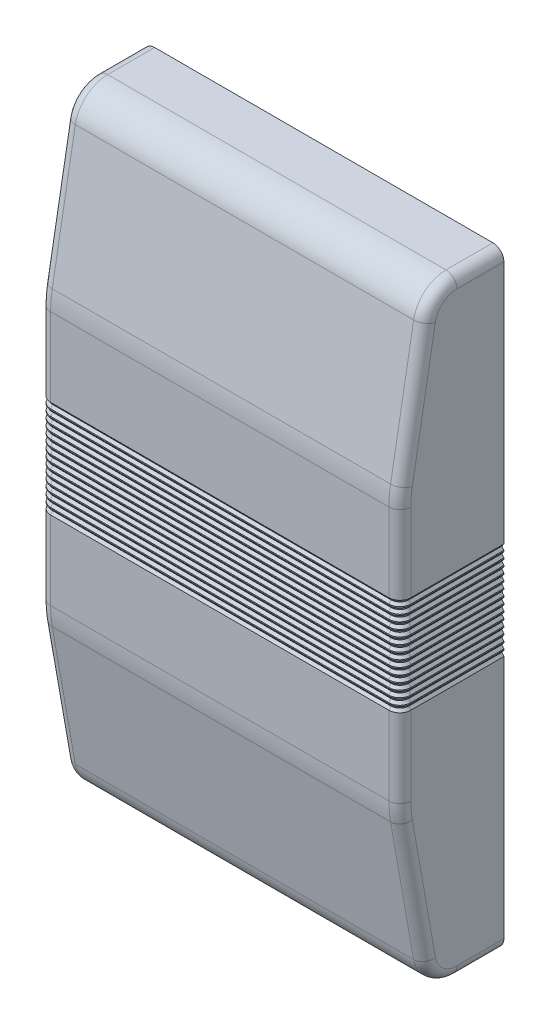
from build123d import *

# Parameters (mm, degrees)
EXTRUDE_SIDE_PROFILE_DEPTH = 65.8
COSMETIC_FILLET_R          = 20
COSMETIC_FILLET_2_R        = 6
COSMETIC_FILLET_3_R        = 2
SHELL1_T                   = -3.2
FILLET_INTERNALS_R         = 1.5
SKETCH3_W                  = 56.4
SKETCH3_H                  = 1.5999999999999952
SKETCH3_H_2                = 1.6000000000000085
EXTRUDE_MATING_BOSS_DEPTH  = 1.5
TOLERANCE_MATING_BOSS_BY   = 0.2
TOLERANCE_MATING_BOSS_2_BY = 0.2
TOLERANCE_MATING_BOSS_3_BY = 0.2
TOLERANCE_MATING_BOSS_4_BY = 0.2
PATTERN_GROOVES_COUNT      = 8
PATTERN_GROOVES_PITCH      = 1.2
PATTERN_GROOVES_COL_COUNT  = 8
PATTERN_GROOVES_COL_PITCH  = 1.2


with BuildPart() as part:
    # Sketch2 → Extrude side profile (new body)
    with BuildSketch(Plane(origin=(0, 0, 0), x_dir=(0, 0, -1), z_dir=(1, 0, 0))):
        Polygon((0, 111.09999999999997), (-13.61321073935639, 111.1), (-19.000000000000014, 80.55), (-19.000000000000014, 30.549999999999994), (-13.61321073935639, 0), (0, 0), align=None)
    extrude(amount=EXTRUDE_SIDE_PROFILE_DEPTH)

    # Cosmetic fillet
    cosmetic_fillet_edges = [part.edges().sort_by_distance(p)[0] for p in [
        (32.9, 30.549999999999994, 19.000000000000014),
        (32.9, 80.55, 19.000000000000014),
    ]]
    fillet(cosmetic_fillet_edges, radius=COSMETIC_FILLET_R)

    # Cosmetic fillet 2
    cosmetic_fillet_2_edges = [part.edges().sort_by_distance(p)[0] for p in [
        (32.9, 0, 13.61321073935639),
        (32.9, 111.1, 13.61321073935639),
    ]]
    fillet(cosmetic_fillet_2_edges, radius=COSMETIC_FILLET_2_R)

    # Cosmetic fillet 3
    cosmetic_fillet_3_edges = [part.edges().sort_by_distance(p)[0] for p in [
        (0, 55.5499999999999, 19.000000000000014),
        (65.8, 55.5499999999999, 19.000000000000014),
        (0, 16.892460325589084, 16.591807265305057),
        (0, 30.556658415565202, 18.923893961834924),
        (0, 80.54334158443459, 18.923893961834935),
        (65.8, 16.892460325589084, 16.591807265305057),
        (65.8, 30.556658415565202, 18.923893961834924),
        (65.8, 80.54334158443459, 18.923893961834935),
        (0, 0, 4.289306476146356),
        (65.8, 0, 4.289306476146356),
        (0, 94.20753967441081, 16.591807265305075),
        (0, 109.69626665871385, 12.435338610411943),
        (0, 1.4037333412861264, 12.435338610411943),
        (65.8, 94.20753967441081, 16.591807265305075),
        (65.8, 109.69626665871385, 12.435338610411943),
        (65.8, 1.4037333412861264, 12.435338610411943),
        (0, 111.09999999999998, 4.28930647614635),
        (65.8, 111.09999999999998, 4.28930647614635),
    ]]
    fillet(cosmetic_fillet_3_edges, radius=COSMETIC_FILLET_3_R)

    # Shell1
    shell1_openings = [part.faces().sort_by_distance(p)[0] for p in [
        (32.9, 55.55, 0),
    ]]
    offset(amount=SHELL1_T, openings=shell1_openings, kind=Kind.INTERSECTION)

    # Fillet internals
    fillet_internals_edges = [part.edges().sort_by_distance(p)[0] for p in [
        (62.599999999999994, 107.89999999999998, 4.289306476146353),
        (62.6, 93.65186550587661, 13.440422455666013),
        (62.599999999999994, 55.5499999999999, 15.800000000000015),
        (62.6, 17.44813449412326, 13.440422455665992),
        (62.599999999999994, 3.2000000000000015, 4.289306476146356),
        (3.2, 3.2000000000000015, 4.289306476146356),
        (3.2, 3.855075559266859, 10.378418259415021),
        (3.2000000000000006, 17.44813449412326, 13.440422455665992),
        (3.2, 30.83555679235771, 15.736070927941341),
        (3.2, 55.5499999999999, 15.800000000000015),
        (3.2, 80.26444320764209, 15.736070927941352),
        (3.2000000000000006, 93.65186550587661, 13.440422455666013),
        (3.2, 107.24492444073312, 10.378418259415017),
        (3.2, 107.89999999999998, 4.289306476146353),
        (62.599999999999994, 80.26444320764209, 15.736070927941352),
        (62.599999999999994, 30.83555679235771, 15.736070927941341),
        (62.599999999999994, 3.855075559266859, 10.378418259415021),
        (62.599999999999994, 107.24492444073312, 10.378418259415017),
    ]]
    fillet(fillet_internals_edges, radius=FILLET_INTERNALS_R)

    # Sketch3 → Extrude mating boss (add)
    with BuildSketch(Plane(origin=(0, 0, 0), x_dir=(-1, 0, 0), z_dir=(0, 0, -1))):
        Polygon((-1.600000000000004, 4.7), (-1.600000000000004, 106.39999999999996), (-3.199999999999998, 106.39999999999996), (-3.1999999999999944, 4.699999999999996), align=None)
        with Locations((-32.900000000000006, 2.399999999999997)):
            Rectangle(SKETCH3_W, SKETCH3_H)
        Polygon((-64.19999999999999, 106.39999999999996), (-64.19999999999999, 4.699999999999996), (-62.6, 4.699999999999997), (-62.6, 106.39999999999996), align=None)
        with Locations((-32.900000000000006, 108.69999999999996)):
            Rectangle(SKETCH3_W, SKETCH3_H_2)
    extrude(amount=EXTRUDE_MATING_BOSS_DEPTH)

    # Tolerance mating boss: a face moved inward by 0.2
    extrude(part.faces().sort_by_distance((32.9, 109.5, -0.75))[0], amount=TOLERANCE_MATING_BOSS_BY, dir=(0, -1, 0), mode=Mode.SUBTRACT)

    # Tolerance mating boss 2: a face moved inward by 0.2
    extrude(part.faces().sort_by_distance((1.6, 55.55, -0.75))[0], amount=TOLERANCE_MATING_BOSS_2_BY, dir=(1, 0, 0), mode=Mode.SUBTRACT)

    # Tolerance mating boss 3: a face moved inward by 0.2
    extrude(part.faces().sort_by_distance((32.9, 1.6, -0.75))[0], amount=TOLERANCE_MATING_BOSS_3_BY, dir=(0, 1, 0), mode=Mode.SUBTRACT)

    # Tolerance mating boss 4: a face moved inward by 0.2
    extrude(part.faces().sort_by_distance((64.2, 55.55, -0.75))[0], amount=TOLERANCE_MATING_BOSS_4_BY, dir=(-1, 0, 0), mode=Mode.SUBTRACT)

    # Cut groove: sweep along a path in Intersection curve
    with BuildLine(Plane(origin=(0, 55.549999999999976, -5.663e-14), x_dir=(1, 0, 0), z_dir=(0, 1, -5.4e-16))) as cut_groove_path:
        Line((0, -2.975e-14), (0, -17.000000000000075))
        ThreePointArc((0, -17.000000000000075), (0.5857864376269051, -18.41421356237317), (2.0000000000000018, -19.00000000000007))
        Line((2.0000000000000018, -19.00000000000007), (63.8, -19.00000000000007))
        ThreePointArc((63.8, -19.00000000000007), (65.21421356237309, -18.414213562373167), (65.8, -17.000000000000075))
        Line((65.8, -17.000000000000075), (65.8, -2.975e-14))
    # Cut profile → Cut groove (sweep, cut)
    with BuildSketch(Plane(origin=(0, 0, 0), x_dir=(-1, 0, 0), z_dir=(0, 0, -1))):
        Polygon((-65.8, 56.050000000000054), (-65.44989623089515, 55.550000000000054), (-65.8, 55.05000000000005), align=None)
    cut_groove = sweep(path=cut_groove_path.line, mode=Mode.SUBTRACT)

    # Pattern grooves: Cut groove ×8
    with Locations(*[(0, i * PATTERN_GROOVES_PITCH, 0) for i in range(1, PATTERN_GROOVES_COUNT)]):
        add(cut_groove, mode=Mode.SUBTRACT)

    # Pattern grooves col: Cut groove ×8
    with Locations(*[(0, -i * PATTERN_GROOVES_COL_PITCH, 0) for i in range(1, PATTERN_GROOVES_COL_COUNT)]):
        add(cut_groove, mode=Mode.SUBTRACT)


solid = part.part
